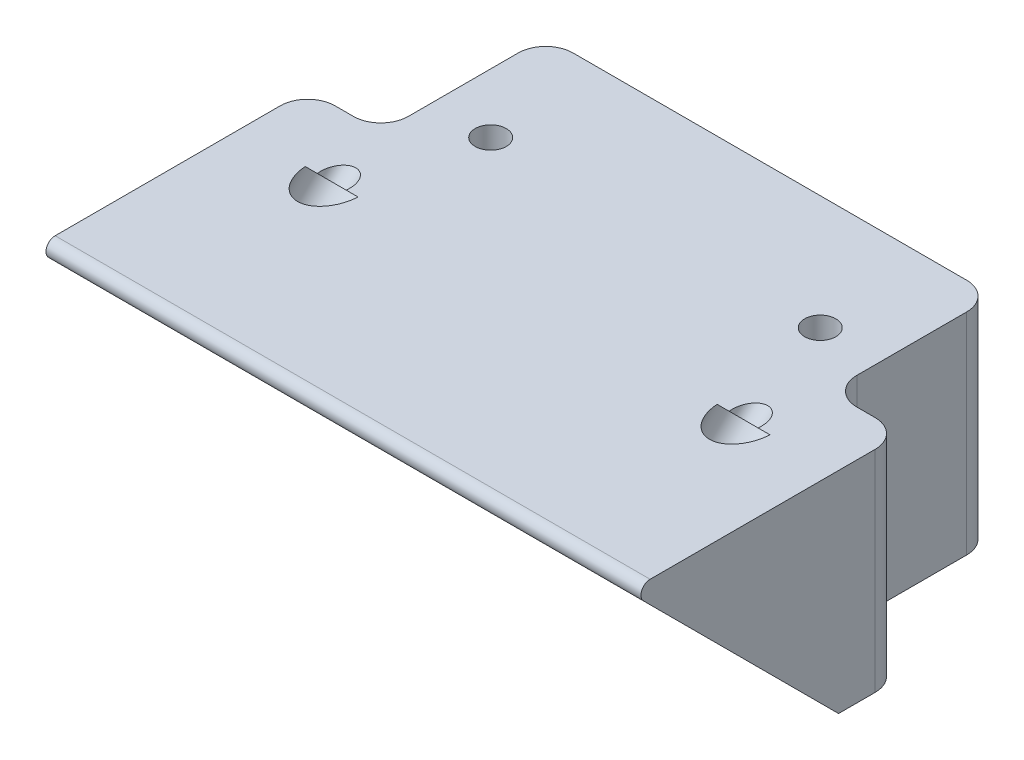
from build123d import *

# Parameters (mm, degrees)
SKETCH_1_W               = 65
SKETCH_1_H               = 25
EXTRUDE_1_DEPTH          = 23
EXTRUDE_2_DEPTH          = 65
SKETCH_3_W               = 25
SKETCH_3_H               = 20
CUT_EXTRUDE_1_DEPTH      = 18
CUT_EXTRUDE_2_DEPTH      = 53.605845683
CUT_EXTRUDE_2_DEPTH_BACK = 53.605845683
SKETCH_4_R               = 1.6
CUT_EXTRUDE_START        = -7
SKETCH_5_R               = 2.9
CUT_EXTRUDE_3_DEPTH      = 9
CUT_EXTRUDE_4_DEPTH      = 54.343228249
CUT_EXTRUDE_4_DEPTH_BACK = 54.343228249
SKETCH_6_R               = 1.7
FILLET_1_R               = 1
SKETCH_7_W               = 8
SKETCH_7_H               = 18
CUT_EXTRUDE_5_DEPTH      = 40
FILLET_2_R               = 3


with BuildPart() as part:
    # 草图1 → 凸台-拉伸1 (new body)
    with BuildSketch(Plane(origin=(0, 0, 0), x_dir=(1, 0, 0), z_dir=(0, 1, 0))):
        Rectangle(SKETCH_1_W, SKETCH_1_H)
    extrude(amount=EXTRUDE_1_DEPTH)

    # 草图2 → 凸台-拉伸2 (add)
    with BuildSketch(Plane(origin=(32.5, 0, 0), x_dir=(0, 0, -1), z_dir=(1, 0, 0))):
        Polygon((-12.5, 0), (-35.5, 23), (-12.5, 23), align=None)
    extrude(amount=-EXTRUDE_2_DEPTH)

    # 草图3 → 切除-拉伸1 (cut)
    with BuildSketch(Plane.XZ):
        with Locations((0, -2.5)):
            Rectangle(SKETCH_3_W, SKETCH_3_H)
    extrude(amount=-CUT_EXTRUDE_1_DEPTH, mode=Mode.SUBTRACT)

    # 草图4 → 切除-拉伸2 (cut, two sides: drawn at the far end of the back side and taken through both)
    with BuildSketch(Plane(origin=(0, -6.25, 6.25), x_dir=(1, 0, 0), z_dir=(0, -0.7071067811865489, 0.7071067811865462)).offset(-CUT_EXTRUDE_2_DEPTH_BACK)):
        with Locations(Location((-22.5, 25.102290732, 0), (0, 0, 270))):
            Circle(SKETCH_4_R)
        with Locations(Location((22.5, 25.102290732, 0), (0, 0, 270))):
            Circle(SKETCH_4_R)
    extrude(amount=CUT_EXTRUDE_2_DEPTH + CUT_EXTRUDE_2_DEPTH_BACK, mode=Mode.SUBTRACT)

    # 草图5 → 切除-拉伸3 (cut)
    with BuildSketch(Plane(origin=(0, -6.25, 6.25), x_dir=(1, 0, 0), z_dir=(0, -0.7071067811865489, 0.7071067811865462)).offset(CUT_EXTRUDE_START)):
        with Locations(Location((-22.5, 25.102290732, 0), (0, 0, 270))):
            Circle(SKETCH_5_R)
        with Locations(Location((22.5, 25.102290732, 0), (0, 0, 174.787670359))):
            Circle(SKETCH_5_R)
    extrude(amount=-CUT_EXTRUDE_3_DEPTH, mode=Mode.SUBTRACT)

    # 草图6 → 切除-拉伸4 (cut, two sides: drawn at the far end of the back side and taken through both)
    with BuildSketch(Plane.XZ.offset(-CUT_EXTRUDE_4_DEPTH_BACK)):
        with Locations(Location((-18, 0, 0), (0, 0, 270))):
            Circle(SKETCH_6_R)
        with Locations(Location((18, 0, 0), (0, 0, 270))):
            Circle(SKETCH_6_R)
    extrude(amount=CUT_EXTRUDE_4_DEPTH + CUT_EXTRUDE_4_DEPTH_BACK, mode=Mode.SUBTRACT)

    # 圆角1
    fillet_1_edges = [part.edges().sort_by_distance(p)[0] for p in [
        (0, 23, 35.5),
    ]]
    fillet(fillet_1_edges, radius=FILLET_1_R)

    # 草图7 → 切除-拉伸5 (cut)
    with BuildSketch(Plane(origin=(0, 23, 0), x_dir=(1, 0, 0), z_dir=(0, 1, 0))):
        with Locations((-28.5, 3.5)):
            Rectangle(SKETCH_7_W, SKETCH_7_H)
        with Locations((28.5, 3.5)):
            Rectangle(SKETCH_7_W, SKETCH_7_H)
    extrude(amount=-CUT_EXTRUDE_5_DEPTH, mode=Mode.SUBTRACT)

    # 圆角2
    fillet_2_edges = [part.edges().sort_by_distance(p)[0] for p in [
        (-32.5, 11.5, 5.5),
        (-24.5, 11.5, -12.5),
        (-24.5, 11.5, 5.5),
        (24.5, 11.5, -12.5),
        (32.5, 11.5, 5.5),
        (24.5, 11.5, 5.5),
    ]]
    fillet(fillet_2_edges, radius=FILLET_2_R)


solid = part.part
